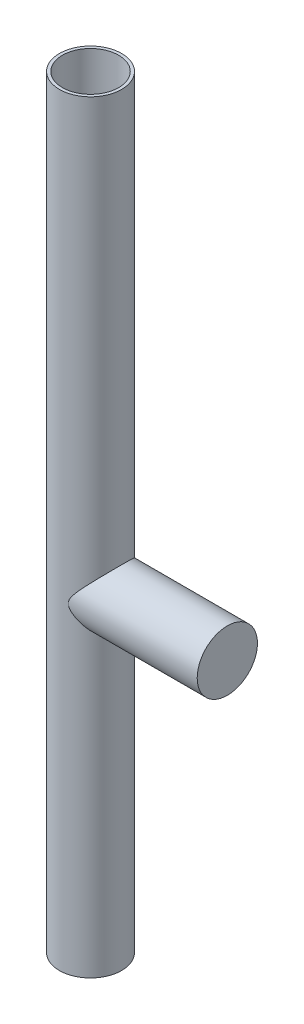
from build123d import *

# Parameters (mm, degrees)
BOSS_EXTRUDE1_DEPTH      = 160
BOSS_EXTRUDE1_DEPTH_BACK = 5
SKETCH1_R                = 7.75
SKETCH1_R_2              = 7
SKETCH5_R                = 7.5
BOSS_EXTRUDE3_DEPTH      = 72.0622032
SKETCH7_R                = 7.75
SKETCH7_R_2              = 7
BOSS_EXTRUDE5_DEPTH      = 25
CUT_EXTRUDE1_START       = -38
SKETCH8_R                = 7.5
CUT_EXTRUDE1_DEPTH       = 38
SKETCH9_R                = 7
CUT_EXTRUDE2_DEPTH       = 105


with BuildPart() as part:
    # Sketch1 → Boss-Extrude1 (new, two sides: drawn at the far end of the back side and taken through both)
    with BuildSketch(Plane(origin=(0, 0, 0), x_dir=(1, 0, 0), z_dir=(0, 1, 0)).offset(-BOSS_EXTRUDE1_DEPTH_BACK)):
        with Locations(Location((0, 0, 0), (0, 0, 270))):
            Circle(SKETCH1_R)
        with Locations(Location((0, 0, 0), (0, 0, 270))):
            Circle(SKETCH1_R_2, mode=Mode.SUBTRACT)
    extrude(amount=BOSS_EXTRUDE1_DEPTH + BOSS_EXTRUDE1_DEPTH_BACK)

    # Sketch5 → Boss-Extrude3 (add)
    with BuildSketch(Plane(origin=(0, 0, 0), x_dir=(0, 0, -1), z_dir=(1, 0, 0))):
        with Locations(Location((0, 75, 0), (0, 0, 180))):
            Circle(SKETCH5_R)
    extrude(amount=BOSS_EXTRUDE3_DEPTH)

    # Sketch7 → Boss-Extrude5 (add)
    with BuildSketch(Plane(origin=(0, 160, 0), x_dir=(1, 0, 0), z_dir=(0, 1, 0))):
        with Locations(Location((0, 0, 0), (0, 0, 270))):
            Circle(SKETCH7_R)
        with Locations(Location((0, 0, 0), (0, 0, 270))):
            Circle(SKETCH7_R_2, mode=Mode.SUBTRACT)
    extrude(amount=BOSS_EXTRUDE5_DEPTH)

    # Sketch8 → Cut-Extrude1 (cut)
    with BuildSketch(Plane(origin=(72.0622032, 0, 0), x_dir=(0, 0, -1), z_dir=(1, 0, 0)).offset(CUT_EXTRUDE1_START)):
        with Locations(Location((0, 75, 0), (0, 0, 180))):
            Circle(SKETCH8_R)
    extrude(amount=CUT_EXTRUDE1_DEPTH, mode=Mode.SUBTRACT)

    # Sketch9 → Cut-Extrude2 (cut)
    with BuildSketch(Plane.XZ.offset(5)):
        with Locations(Location((0, 0, 0), (0, 0, 90))):
            Circle(SKETCH9_R)
    extrude(amount=-CUT_EXTRUDE2_DEPTH, mode=Mode.SUBTRACT)


solid = part.part
